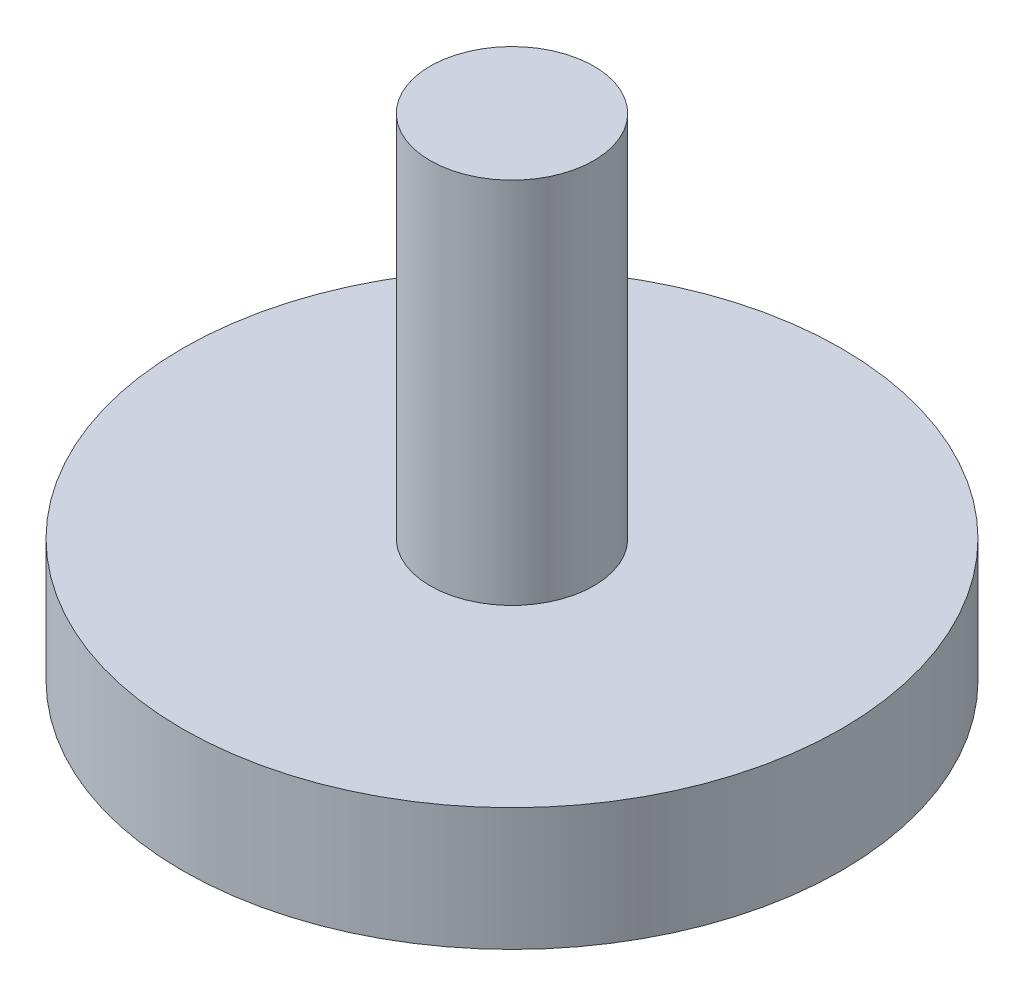
from build123d import *

# Parameters (mm, degrees)
SKETCH1_R           = 51.1302
BOSS_EXTRUDE1_DEPTH = 9.525
SKETCH2_R           = 12.7
BOSS_EXTRUDE2_DEPTH = 57.15


with BuildPart() as part:
    # Sketch1 → Boss-Extrude1 (new, symmetric)
    with BuildSketch(Plane(origin=(0, 0, 0), x_dir=(1, 0, 0), z_dir=(0, 1, 0))):
        with Locations(Location((0, 0, 0), (0, 0, 90))):
            Circle(SKETCH1_R)
    extrude(amount=BOSS_EXTRUDE1_DEPTH, both=True)

    # Sketch2 → Boss-Extrude2 (add)
    with BuildSketch(Plane(origin=(0, 9.525, 0), x_dir=(1, 0, 0), z_dir=(0, 1, 0))):
        with Locations(Location((0, 0, 0), (0, 0, 270))):
            Circle(SKETCH2_R)
    extrude(amount=BOSS_EXTRUDE2_DEPTH)


solid = part.part
